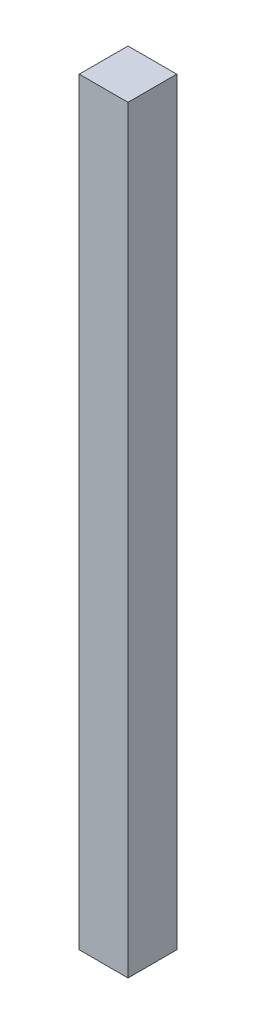
from build123d import *

# Parameters (mm, degrees)
SKETCH1_W           = 20
SKETCH1_H           = 20
BOSS_EXTRUDE1_DEPTH = 311


with BuildPart() as part:
    # Sketch1 → Boss-Extrude1 (new body)
    with BuildSketch(Plane(origin=(0, 0, 0), x_dir=(1, 0, 0), z_dir=(0, 1, 0))):
        with Locations((10, 10)):
            Rectangle(SKETCH1_W, SKETCH1_H)
    extrude(amount=BOSS_EXTRUDE1_DEPTH)


solid = part.part
